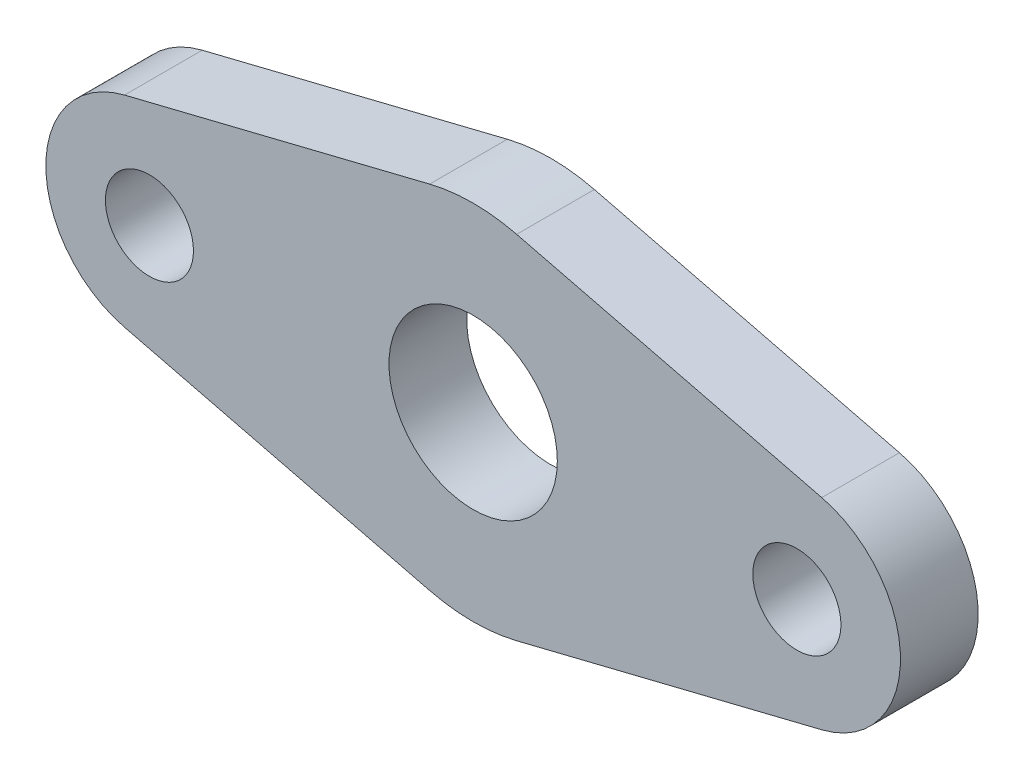
from build123d import *

# Parameters (mm, degrees)
SKETCH_1_R      = 1.7
SKETCH_1_R_2    = 3.25
EXTRUDE_1_DEPTH = 3


with BuildPart() as part:
    # 草图1 → 凸台-拉伸1 (new body)
    with BuildSketch(Plane.XY):
        with BuildLine():
            Line((-13.46, 3.883091552), (-1.68, 6.795410216))
            ThreePointArc((-1.68, 6.795410216), (0, 7), (1.68, 6.795410216))
            Line((1.68, 6.795410216), (13.46, 3.883091552))
            ThreePointArc((13.46, 3.883091552), (16.5, 0), (13.46, -3.883091552))
            Line((13.46, -3.883091552), (1.68, -6.795410216))
            ThreePointArc((1.68, -6.795410216), (0, -7), (-1.68, -6.795410216))
            Line((-1.68, -6.795410216), (-13.46, -3.883091552))
            ThreePointArc((-13.46, -3.883091552), (-16.5, 0), (-13.46, 3.883091552))
        make_face()
        with Locations((-12.5, 0)):
            Circle(SKETCH_1_R, mode=Mode.SUBTRACT)
        Circle(SKETCH_1_R_2, mode=Mode.SUBTRACT)
        with Locations(Location((12.5, 0, 0), (0, 0, 180))):
            Circle(SKETCH_1_R, mode=Mode.SUBTRACT)
    extrude(amount=EXTRUDE_1_DEPTH)


solid = part.part
